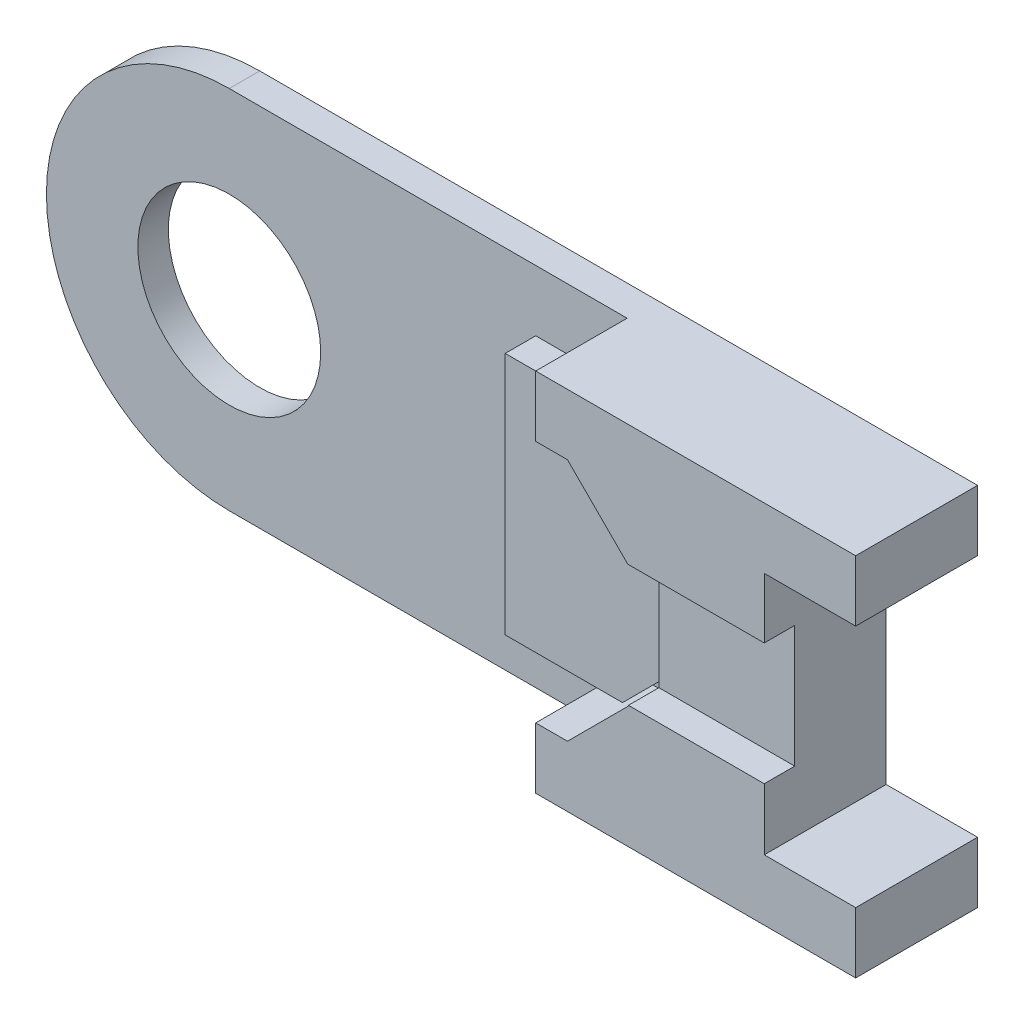
from build123d import *

# Parameters (mm, degrees)
SKETCH2_R           = 30
BOSS_EXTRUDE2_DEPTH = 10
SKETCH4_W           = 39.74410588
SKETCH4_H           = 80
CUT_EXTRUDE1_DEPTH  = 30
SKETCH5_W           = 105
SKETCH5_H           = 120
BOSS_EXTRUDE3_DEPTH = 40
SKETCH6_W           = 78.106224714
SKETCH6_H           = 80
CUT_EXTRUDE2_DEPTH  = 30
SKETCH7_W           = 45
SKETCH7_H           = 40
CUT_EXTRUDE3_DEPTH  = 10
CUT_EXTRUDE4_DEPTH  = 30
BOSS_EXTRUDE4_DEPTH = 10


with BuildPart() as part:
    # Sketch2 → Boss-Extrude2 (new body)
    with BuildSketch(Plane.XY):
        with BuildLine():
            Line((46.207044142, 120), (-84.343419201, 120))
            ThreePointArc((-84.343419201, 120), (-144.343419201, 60), (-84.343419201, 0))
            Line((-84.343419201, 0), (0, 0))
            Line((0, 0), (151.207044142, 0))
            Line((151.207044142, 0), (151.207044142, 120))
            Line((151.207044142, 120), (46.207044142, 120))
        make_face()
        with Locations((-84.343419201, 60)):
            Circle(SKETCH2_R, mode=Mode.SUBTRACT)
    extrude(amount=BOSS_EXTRUDE2_DEPTH)

    # Sketch4 → Cut-Extrude1 (cut)
    with BuildSketch(Plane(origin=(151.207044142, 0, 0), x_dir=(0, 0, -1), z_dir=(1, 0, 0))):
        with Locations((-1.423296347, 60)):
            Rectangle(SKETCH4_W, SKETCH4_H)
    extrude(amount=-CUT_EXTRUDE1_DEPTH, mode=Mode.SUBTRACT)

    # Sketch5 → Boss-Extrude3 (add)
    with BuildSketch(Plane.XY):
        with Locations((98.707044142, 60)):
            Rectangle(SKETCH5_W, SKETCH5_H)
    extrude(amount=BOSS_EXTRUDE3_DEPTH)

    # Sketch6 → Cut-Extrude2 (cut)
    with BuildSketch(Plane(origin=(151.207044142, 0, 0), x_dir=(0, 0, -1), z_dir=(1, 0, 0))):
        with Locations((-16.932746975, 60)):
            Rectangle(SKETCH6_W, SKETCH6_H)
    extrude(amount=-CUT_EXTRUDE2_DEPTH, mode=Mode.SUBTRACT)

    # Sketch7 → Cut-Extrude3 (cut)
    with BuildSketch(Plane.XY.offset(40)):
        with Locations((99.042729198, 60.209092216)):
            Rectangle(SKETCH7_W, SKETCH7_H)
    extrude(amount=-CUT_EXTRUDE3_DEPTH, mode=Mode.SUBTRACT)

    # Sketch8 → Cut-Extrude4 (cut)
    with BuildSketch(Plane.XY.offset(40)):
        Polygon((19.599086243, 100), (56.633635385, 100), (76.633635385, 80), (76.633635385, 40), (56.633635385, 20), (19.599086243, 20), align=None)
    extrude(amount=-CUT_EXTRUDE4_DEPTH, mode=Mode.SUBTRACT)

    # Sketch9 → Boss-Extrude4 (add)
    with BuildSketch(Plane.XY.offset(10)):
        Polygon((46.207044142, 100), (16.207044142, 100), (16.207044142, 20), (46.207044142, 20), (54.69343027, 20), (76.633635385, 41.940205115), (76.633635385, 80), (56.633635385, 100), align=None)
    extrude(amount=BOSS_EXTRUDE4_DEPTH)


solid = part.part
